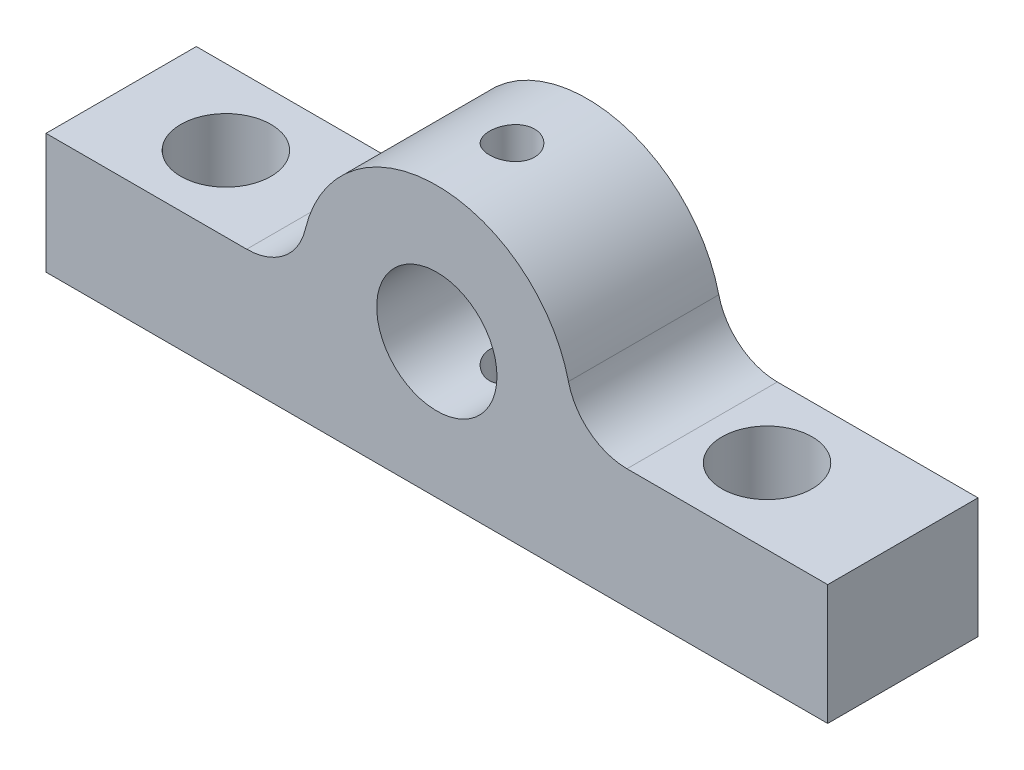
from build123d import *
from build123d.topology import SkipClean

# Parameters (mm, degrees)
BOSS_EXTRUDE1_DEPTH     = 5
SKETCH2_R               = 1.5
CUT_EXTRUDE1_DEPTH      = 5
CUT_EXTRUDE2_DEPTH      = 15.798648587
CUT_EXTRUDE2_DEPTH_BACK = 15.798648587
SKETCH3_R               = 0.75


with BuildPart() as part:
    # Sketch1 → Boss-Extrude1 (new body)
    with BuildSketch(Plane.XY):
        with BuildLine():
            Line((-13, 0), (0, 0))
            Line((0, 0), (0, 2.5))
            ThreePointArc((0, 2.5), (-2, 4.5), (0, 6.5))
            Line((0, 6.5), (0, 9))
            ThreePointArc((0, 9), (-2.790781528, 8.030090432), (-4.378538299, 5.538461538))
            ThreePointArc((-4.378538299, 5.538461538), (-5.084207974, 4.431070919), (-6.32455532, 4))
            Line((-6.32455532, 4), (-13, 4))
            Line((-13, 4), (-13, 0))
        make_face()
        with BuildLine():
            Line((0, 2.5), (0, 0))
            Line((0, 0), (13, 0))
            Line((13, 0), (13, 4))
            Line((13, 4), (6.32455532, 4))
            ThreePointArc((6.32455532, 4), (5.084207974, 4.431070919), (4.378538299, 5.538461538))
            ThreePointArc((4.378538299, 5.538461538), (2.790781528, 8.030090432), (0, 9))
            Line((0, 9), (0, 6.5))
            ThreePointArc((0, 6.5), (1.414213562, 5.914213562), (2, 4.5))
            ThreePointArc((2, 4.5), (1.414213562, 3.085786438), (0, 2.5))
        make_face()
    extrude(amount=BOSS_EXTRUDE1_DEPTH)

    # Sketch2 → Cut-Extrude1 (cut)
    with BuildSketch(Plane(origin=(0, 4, 0), x_dir=(1, 0, 0), z_dir=(0, 1, 0))):
        with Locations(Location((-9.517345142, -2.5, 0), (0, 0, 270))):
            Circle(SKETCH2_R)
        with Locations(Location((8.482654858, -2.5, 0), (0, 0, 270))):
            Circle(SKETCH2_R)
    extrude(amount=-CUT_EXTRUDE1_DEPTH, mode=Mode.SUBTRACT)

    # Sketch3 → Cut-Extrude2 (cut, two sides: drawn at the far end of the back side and taken through both)
    with SkipClean():  # the faces are left unmerged after this step: merging them gives an invalid solid
        with BuildSketch(Plane(origin=(0, 4, 0), x_dir=(1, 0, 0), z_dir=(0, 1, 0)).offset(-CUT_EXTRUDE2_DEPTH_BACK)):
            with Locations(Location((0, -2.5, 0), (0, 0, 90))):
                Circle(SKETCH3_R)
        extrude(amount=CUT_EXTRUDE2_DEPTH + CUT_EXTRUDE2_DEPTH_BACK, mode=Mode.SUBTRACT)


solid = part.part
